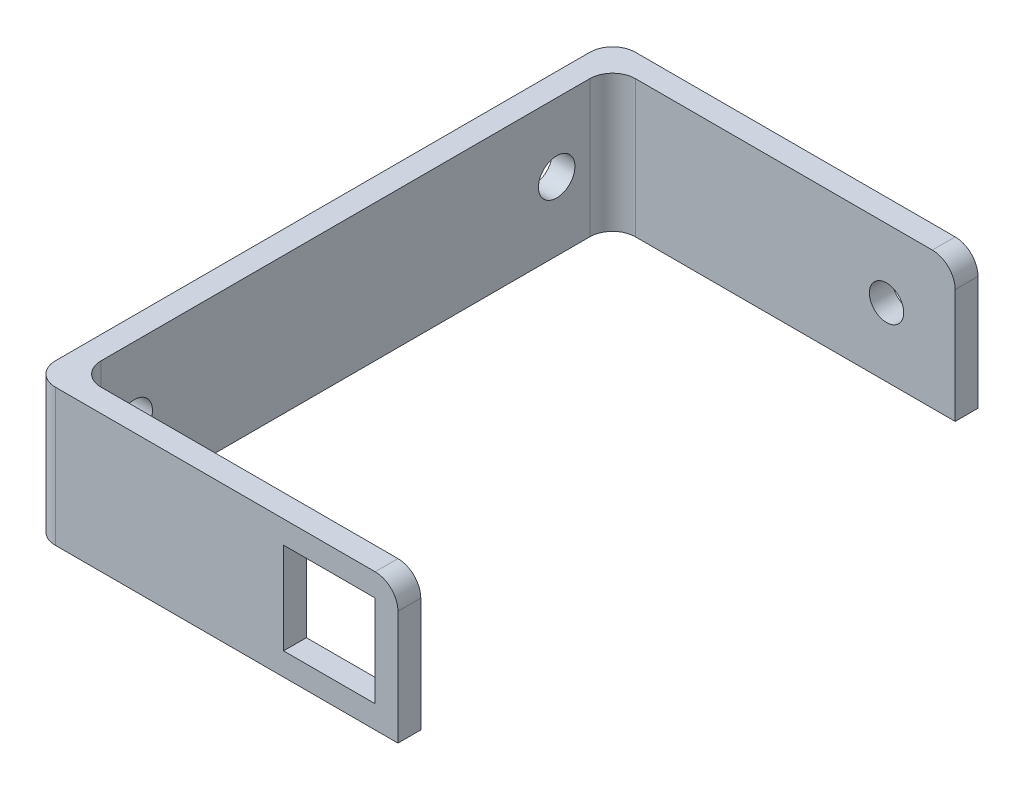
from build123d import *

# Parameters (mm, degrees)
BOSS_EXTRUDE1_DEPTH = 12
SKETCH3_R           = 1.505
CUT_EXTRUDE2_DEPTH  = 4
SKETCH5_R           = 1.6
CUT_EXTRUDE3_DEPTH  = 4
SKETCH6_W           = 8.02
SKETCH6_H           = 8.02
CUT_EXTRUDE4_DEPTH  = 2
FILLET1_R           = 2
FILLET2_R           = 2
FILLET3_R           = 2
FILLET4_R           = 2
FILLET5_R           = 2
FILLET6_R           = 2


with BuildPart() as part:
    # Sketch1 → Boss-Extrude1 (new body)
    with BuildSketch(Plane(origin=(0, 0, 0), x_dir=(1, 0, 0), z_dir=(0, 1, 0))):
        Polygon((0, 0), (-32, 0), (-32, 50.8), (0, 50.8), (0, 48.8), (-30, 48.8), (-30, 2), (0, 2), align=None)
    extrude(amount=BOSS_EXTRUDE1_DEPTH)

    # Sketch3 → Cut-Extrude2 (cut)
    with BuildSketch(Plane(origin=(0, 0, -50.8), x_dir=(-1, 0, 0), z_dir=(0, 0, -1))):
        with Locations((6.01, 6)):
            Circle(SKETCH3_R)
    extrude(amount=-CUT_EXTRUDE2_DEPTH, mode=Mode.SUBTRACT)

    # Sketch5 → Cut-Extrude3 (cut)
    with BuildSketch(Plane.ZY.offset(32)):
        with Locations((-43.9, 6)):
            Circle(SKETCH5_R)
        with Locations((-6.9, 6)):
            Circle(SKETCH5_R)
    extrude(amount=-CUT_EXTRUDE3_DEPTH, mode=Mode.SUBTRACT)

    # Sketch6 → Cut-Extrude4 (cut)
    with BuildSketch(Plane.XY):
        with Locations((-6.01, 6)):
            Rectangle(SKETCH6_W, SKETCH6_H)
    extrude(amount=-CUT_EXTRUDE4_DEPTH, mode=Mode.SUBTRACT)

    # Fillet1
    fillet1_edges = [part.edges().sort_by_distance(p)[0] for p in [
        (0, 12, -1),
    ]]
    fillet(fillet1_edges, radius=FILLET1_R)

    # Fillet2
    fillet2_edges = [part.edges().sort_by_distance(p)[0] for p in [
        (0, 12, -49.8),
    ]]
    fillet(fillet2_edges, radius=FILLET2_R)

    # Fillet3
    fillet3_edges = [part.edges().sort_by_distance(p)[0] for p in [
        (-30, 6, -2),
    ]]
    fillet(fillet3_edges, radius=FILLET3_R)

    # Fillet4
    fillet4_edges = [part.edges().sort_by_distance(p)[0] for p in [
        (-32, 6, 0),
    ]]
    fillet(fillet4_edges, radius=FILLET4_R)

    # Fillet5
    fillet5_edges = [part.edges().sort_by_distance(p)[0] for p in [
        (-30, 6, -48.8),
    ]]
    fillet(fillet5_edges, radius=FILLET5_R)

    # Fillet6
    fillet6_edges = [part.edges().sort_by_distance(p)[0] for p in [
        (-32, 6, -50.8),
    ]]
    fillet(fillet6_edges, radius=FILLET6_R)


solid = part.part
